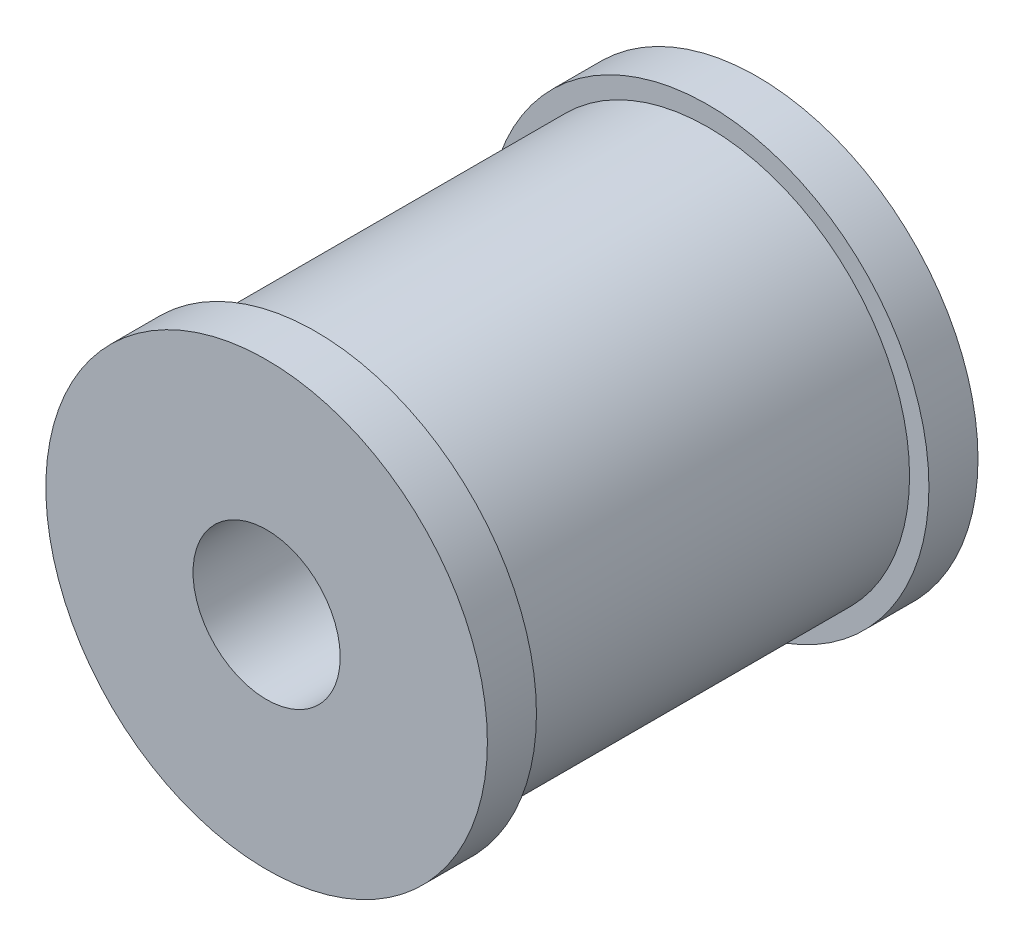
from build123d import *

# Parameters (mm, degrees)
SKETCH_1_R               = 9
SKETCH_1_R_2             = 3
EXTRUDE_1_DEPTH          = 20
CUT_EXTRUDE_1_DEPTH      = 8
CUT_EXTRUDE_1_DEPTH_BACK = 8
SKETCH_3_R               = 18.21
SKETCH_3_R_2             = 8.21


with BuildPart() as part:
    # 草图1 → 凸台-拉伸1 (new body)
    with BuildSketch(Plane.XY):
        Circle(SKETCH_1_R)
        Circle(SKETCH_1_R_2, mode=Mode.SUBTRACT)
    extrude(amount=EXTRUDE_1_DEPTH)

    # 草图3 → 切除-拉伸-薄壁1 (cut, two sides: drawn at the far end of the back side and taken through both)
    with BuildSketch(Plane.XY.offset(10).offset(-CUT_EXTRUDE_1_DEPTH_BACK)):
        Circle(SKETCH_3_R)
        Circle(SKETCH_3_R_2, mode=Mode.SUBTRACT)
    extrude(amount=CUT_EXTRUDE_1_DEPTH + CUT_EXTRUDE_1_DEPTH_BACK, mode=Mode.SUBTRACT)


solid = part.part
